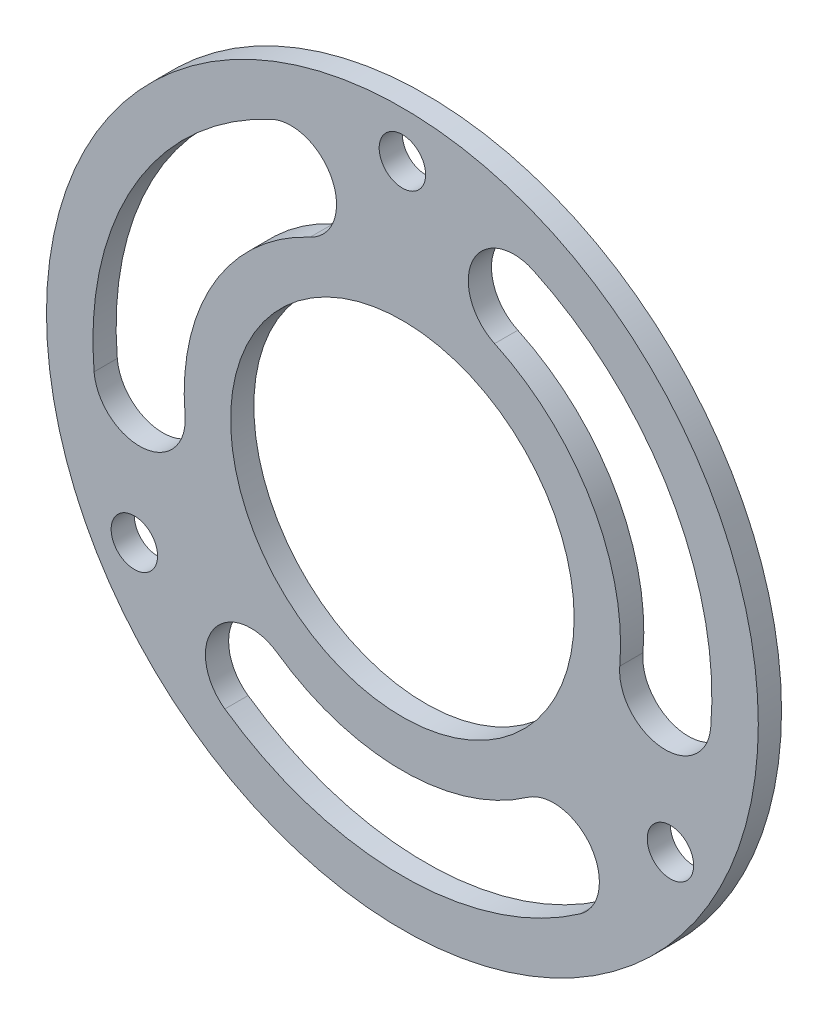
from build123d import *

# Parameters (mm, degrees)
SKETCH_1_R          = 23
SKETCH_1_R_2        = 1.5
SKETCH_1_R_3        = 11.1
EXTRUDE_1_DEPTH     = 1.5
CUT_EXTRUDE_1_DEPTH = 33.56148031


with BuildPart() as part:
    # 草图1 → 凸台-拉伸1 (new body)
    with BuildSketch(Plane.XY):
        Circle(SKETCH_1_R)
        with Locations((0, 20)):
            Circle(SKETCH_1_R_2, mode=Mode.SUBTRACT)
        Circle(SKETCH_1_R_3, mode=Mode.SUBTRACT)
        with Locations((17.320508076, -10)):
            Circle(SKETCH_1_R_2, mode=Mode.SUBTRACT)
        with Locations((-17.320508076, -10)):
            Circle(SKETCH_1_R_2, mode=Mode.SUBTRACT)
    extrude(amount=EXTRUDE_1_DEPTH)

    # 草图2 → 切除-拉伸1 (cut, through all)
    with BuildSketch(Plane.XY.offset(1.5)):
        with BuildLine():
            ThreePointArc((-8.452365235, 18.126155741), (-17.320508076, 10), (-19.923893962, -1.743114855))
            ThreePointArc((-19.923893962, -1.743114855), (-16.728010161, -4.424779773), (-14.046345243, -1.228895973))
            ThreePointArc((-14.046345243, -1.228895973), (-12.210958193, 7.05), (-5.958917491, 12.778939797))
            ThreePointArc((-5.958917491, 12.778939797), (-4.532033391, 16.699271641), (-8.452365235, 18.126155741))
        make_face()
        with BuildLine():
            ThreePointArc((19.923893962, -1.743114855), (17.320508076, 10), (8.452365235, 18.126155741))
            ThreePointArc((8.452365235, 18.126155741), (4.532033391, 16.699271641), (5.958917491, 12.778939797))
            ThreePointArc((5.958917491, 12.778939797), (12.210958193, 7.05), (14.046345243, -1.228895973))
            ThreePointArc((14.046345243, -1.228895973), (16.728010161, -4.424779773), (19.923893962, -1.743114855))
        make_face()
        with BuildLine():
            ThreePointArc((-11.471528727, -16.383040886), (0, -20), (11.471528727, -16.383040886))
            ThreePointArc((11.471528727, -16.383040886), (12.19597677, -12.274491868), (8.087427753, -11.550043824))
            ThreePointArc((8.087427753, -11.550043824), (0, -14.1), (-8.087427753, -11.550043824))
            ThreePointArc((-8.087427753, -11.550043824), (-12.19597677, -12.274491868), (-11.471528727, -16.383040886))
        make_face()
    extrude(amount=-CUT_EXTRUDE_1_DEPTH, mode=Mode.SUBTRACT)


solid = part.part
